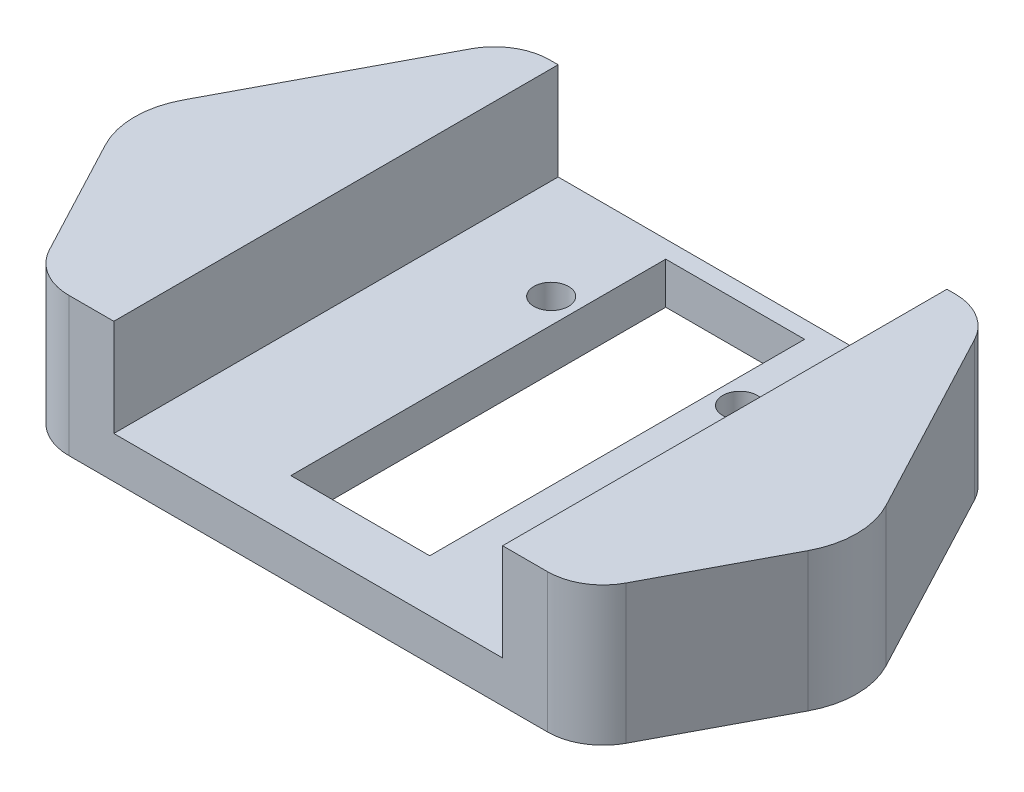
from build123d import *

# Parameters (mm, degrees)
BOSS_EXTRUDE3_DEPTH     = 3
SKETCH14_W              = 3
SKETCH14_H              = 37
BOSS_EXTRUDE8_DEPTH     = 3
SKETCH15_R              = 2
BOSS_EXTRUDE9_DEPTH     = 10
BOSS_EXTRUDE10_START    = -3
SKETCH16_R              = 2
BOSS_EXTRUDE10_DEPTH    = 3
CUT_EXTRUDE6_DEPTH      = 36.65196348
CUT_EXTRUDE6_DEPTH_BACK = 36.65196348
SKETCH18_W              = 39.290830544
SKETCH18_H              = 5
FILLET1_R               = 4
SKETCH19_R              = 1.25
SKETCH19_W              = 10
SKETCH19_H              = 27
CUT_EXTRUDE7_DEPTH      = 10


with BuildPart() as part:
    # Sketch1 → Boss-Extrude3 (new body)
    with BuildSketch(Plane(origin=(0, 0, 0), x_dir=(1, 0, 0), z_dir=(0, 1, 0))):
        Polygon((-14, -6.25), (-14, 13.75), (-14, 22.25), (14, 22.25), (14, 13.75), (14, -6.25), (14, -14.75), (-14, -14.75), align=None)
    extrude(amount=BOSS_EXTRUDE3_DEPTH)

    # Sketch14 → Boss-Extrude8 (add)
    with BuildSketch(Plane.XZ):
        with Locations((-15.5, -3.75)):
            Rectangle(SKETCH14_W, SKETCH14_H)
        with Locations((15.5, -3.75)):
            Rectangle(SKETCH14_W, SKETCH14_H)
    extrude(amount=-BOSS_EXTRUDE8_DEPTH)

    # Sketch15 → Boss-Extrude9 (add)
    # profile 1 of 2: a face of its own
    with BuildSketch(Plane(origin=(0, 0, 0), x_dir=(1, 0, 0), z_dir=(0, 1, 0))):
        with BuildLine():
            Line((-25.3034482, 6.555964573), (-17, 22.25))
            Line((-17, 22.25), (-14, 22.25))
            Line((-14, 22.25), (-14, -14.75))
            Line((-14, -14.75), (-17, -14.75))
            Line((-17, -14.75), (-25.3034482, 0.944035427))
            ThreePointArc((-25.3034482, 0.944035427), (-26, 3.75), (-25.3034482, 6.555964573))
        make_face()
        with Locations(Location((-20, 3.75, 0), (0, 0, 270))):
            Circle(SKETCH15_R, mode=Mode.SUBTRACT)
    # profile 2 of 2: a face of its own
    with BuildSketch(Plane(origin=(0, 0, 0), x_dir=(1, 0, 0), z_dir=(0, 1, 0))):
        with BuildLine():
            Line((17, 22.25), (25.3034482, 6.555964573))
            ThreePointArc((25.3034482, 6.555964573), (26, 3.75), (25.3034482, 0.944035427))
            Line((25.3034482, 0.944035427), (17, -14.75))
            Line((17, -14.75), (14, -14.75))
            Line((14, -14.75), (14, 22.25))
            Line((14, 22.25), (17, 22.25))
        make_face()
        with Locations(Location((20, 3.75, 0), (0, 0, 270))):
            Circle(SKETCH15_R, mode=Mode.SUBTRACT)
    extrude(amount=BOSS_EXTRUDE9_DEPTH)

    # Sketch16 → Boss-Extrude10 (add)
    with BuildSketch(Plane(origin=(0, 10, 0), x_dir=(1, 0, 0), z_dir=(0, 1, 0)).offset(BOSS_EXTRUDE10_START)):
        with Locations(Location((20, 3.75, 0), (0, 0, 270))):
            Circle(SKETCH16_R)
        with Locations(Location((-20, 3.75, 0), (0, 0, 270))):
            Circle(SKETCH16_R)
    extrude(amount=BOSS_EXTRUDE10_DEPTH)

    # Sketch18 → Cut-Extrude6 (cut, two sides: drawn at the far end of the back side and taken through both)
    with BuildSketch(Plane.XZ.offset(-CUT_EXTRUDE6_DEPTH_BACK)):
        with Locations((0, 12.25)):
            Rectangle(SKETCH18_W, SKETCH18_H)
    extrude(amount=CUT_EXTRUDE6_DEPTH + CUT_EXTRUDE6_DEPTH_BACK, mode=Mode.SUBTRACT)

    # Fillet1
    fillet1_edges = [part.edges().sort_by_distance(p)[0] for p in [
        (19.645415272, 5, 9.75),
        (-19.645415272, 5, 9.75),
        (-17, 5, -22.25),
        (17, 5, -22.25),
    ]]
    fillet(fillet1_edges, radius=FILLET1_R)

    # Sketch19 → Cut-Extrude7 (cut)
    with BuildSketch(Plane(origin=(0, 3, 0), x_dir=(1, 0, 0), z_dir=(0, 1, 0))):
        with Locations(Location((-6.8, 14.55, 0), (0, 0, 270))):
            Circle(SKETCH19_R)
        with Locations(Location((6.8, 14.55, 0), (0, 0, 270))):
            Circle(SKETCH19_R)
        with Locations((0, 7.5)):
            Rectangle(SKETCH19_W, SKETCH19_H)
    extrude(amount=-CUT_EXTRUDE7_DEPTH, mode=Mode.SUBTRACT)


solid = part.part
